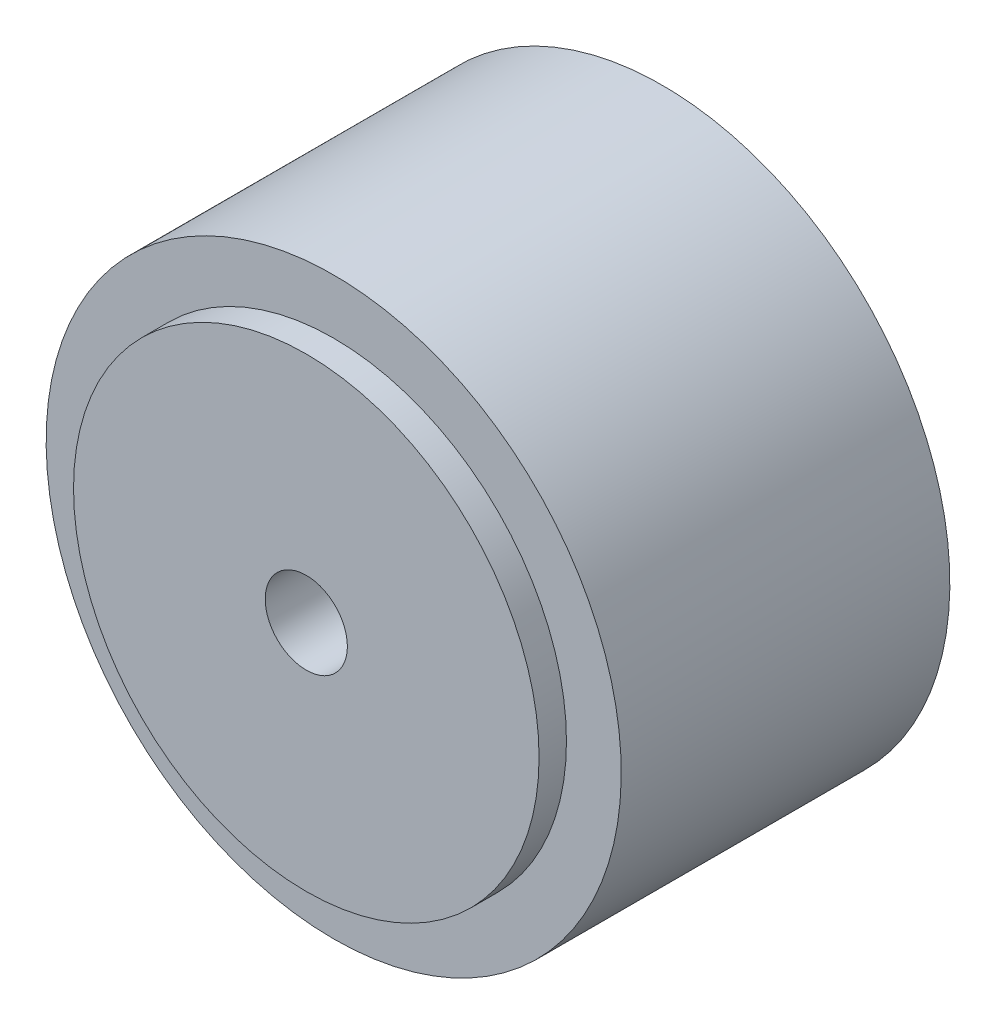
from build123d import *

# Parameters (mm, degrees)
F_3_0_3_DIAMETER_HOLE1_D = 3
CHAMFER1_SIZE            = 1


with BuildPart() as part:
    # Sketch1 → Revolve1 (revolve)
    with BuildSketch(Plane(origin=(0, 0, 0), x_dir=(0, 0, -1), z_dir=(1, 0, 0)), mode=Mode.PRIVATE) as revolve1_sk:
        Polygon((0, 0), (0, 8.5), (1, 8.5), (1, 10.5), (13, 10.5), (13, 8.5), (14, 8.5), (14, 5.5), (3, 5.5), (3, 0), align=None)
    revolve(revolve1_sk.sketch.rotate(Axis((0, 0, 21.219054242), (0, 0, -1)), 180), axis=Axis((0, 0, 21.219054242), (0, 0, -1)))

    # Ø3.0 (3) Diameter Hole1 (through all)
    with Locations(Plane.XY):
        with Locations((0, 0)):
            Hole(F_3_0_3_DIAMETER_HOLE1_D / 2)

    # Chamfer1
    chamfer1_edges = [part.edges().sort_by_distance(p)[0] for p in [
        (0, 5.5, -14),
    ]]
    chamfer(chamfer1_edges, length=CHAMFER1_SIZE)


solid = part.part
